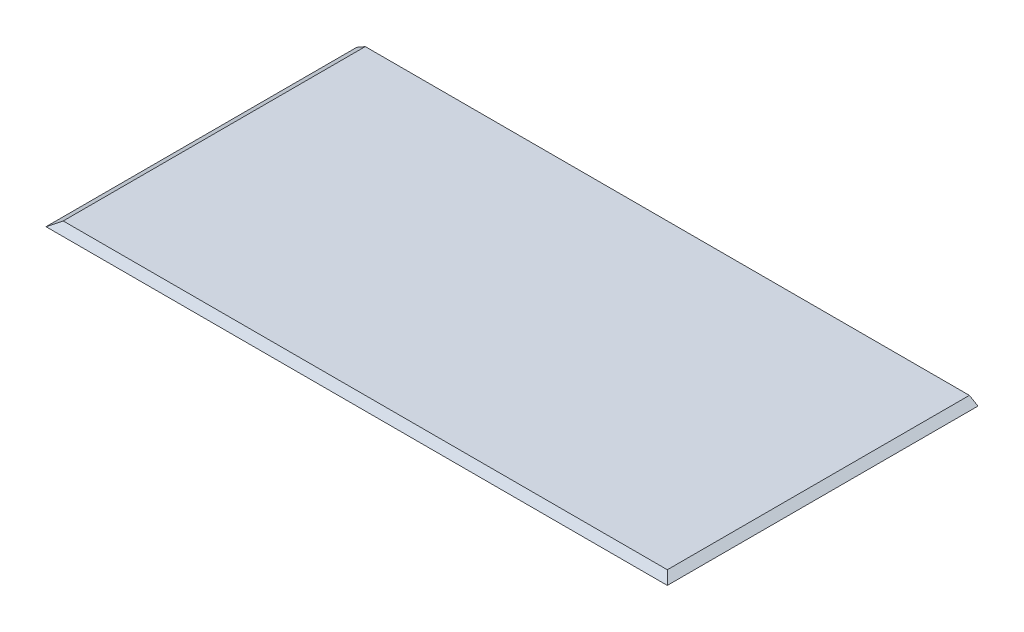
from build123d import *

# Parameters (mm, degrees)
SKETCH_1_W               = 250
SKETCH_1_H               = 250
EXTRUDE_1_DEPTH          = 2
SKETCH_2_W               = 250
SKETCH_2_H               = 125
CUT_EXTRUDE_1_DEPTH      = 2
SKETCH_6_W               = 10
SKETCH_6_H               = 10
EXTRUDE_3_DEPTH          = 10
CUT_EXTRUDE_2_DEPTH      = 125
CUT_EXTRUDE_3_DEPTH      = 178.059312096
CUT_EXTRUDE_3_DEPTH_BACK = 178.059312096


with BuildPart() as part:
    # 草图1 → 凸台-拉伸1 (new body)
    with BuildSketch(Plane(origin=(0, 0, 0), x_dir=(1, 0, 0), z_dir=(0, 1, 0))):
        Rectangle(SKETCH_1_W, SKETCH_1_H)
    extrude(amount=EXTRUDE_1_DEPTH)

    # 草图2 → 切除-拉伸1 (cut)
    with BuildSketch(Plane(origin=(0, 2, 0), x_dir=(1, 0, 0), z_dir=(0, 1, 0))):
        with Locations((0, -62.5)):
            Rectangle(SKETCH_2_W, SKETCH_2_H)
    extrude(amount=-CUT_EXTRUDE_1_DEPTH, mode=Mode.SUBTRACT)

    # 草图6 → 凸台-拉伸3 (add)
    with BuildSketch(Plane.XZ):
        with Locations((-105.253353702, -19.703268914)):
            Rectangle(SKETCH_6_W, SKETCH_6_H)
        with Locations((-105.253353702, -104.703268914)):
            Rectangle(SKETCH_6_W, SKETCH_6_H)
        with Locations((104.746646298, -19.703268914)):
            Rectangle(SKETCH_6_W, SKETCH_6_H)
        with Locations((104.746646298, -104.703268914)):
            Rectangle(SKETCH_6_W, SKETCH_6_H)
    extrude(amount=EXTRUDE_3_DEPTH)

    # 草图9 → 切除-拉伸2 (cut)
    with BuildSketch(Plane(origin=(0, 0, -125), x_dir=(-1, 0, 0), z_dir=(0, 0, -1))):
        Polygon((-125, 0), (-125, 2), (-121.535898385, 2), align=None)
        Polygon((125, 2), (121.535898385, 2), (125, 0), align=None)
    extrude(amount=-CUT_EXTRUDE_2_DEPTH, mode=Mode.SUBTRACT)

    # 草图11 → 切除-拉伸3 (cut, two sides: drawn at the far end of the back side and taken through both)
    with BuildSketch(Plane(origin=(0, 0, 0), x_dir=(0, 0, -1), z_dir=(1, 0, 0)).offset(-CUT_EXTRUDE_3_DEPTH_BACK)):
        Polygon((0, 2), (0, 0), (3.464101615, 2), align=None)
    extrude(amount=CUT_EXTRUDE_3_DEPTH + CUT_EXTRUDE_3_DEPTH_BACK, mode=Mode.SUBTRACT)


solid = part.part
